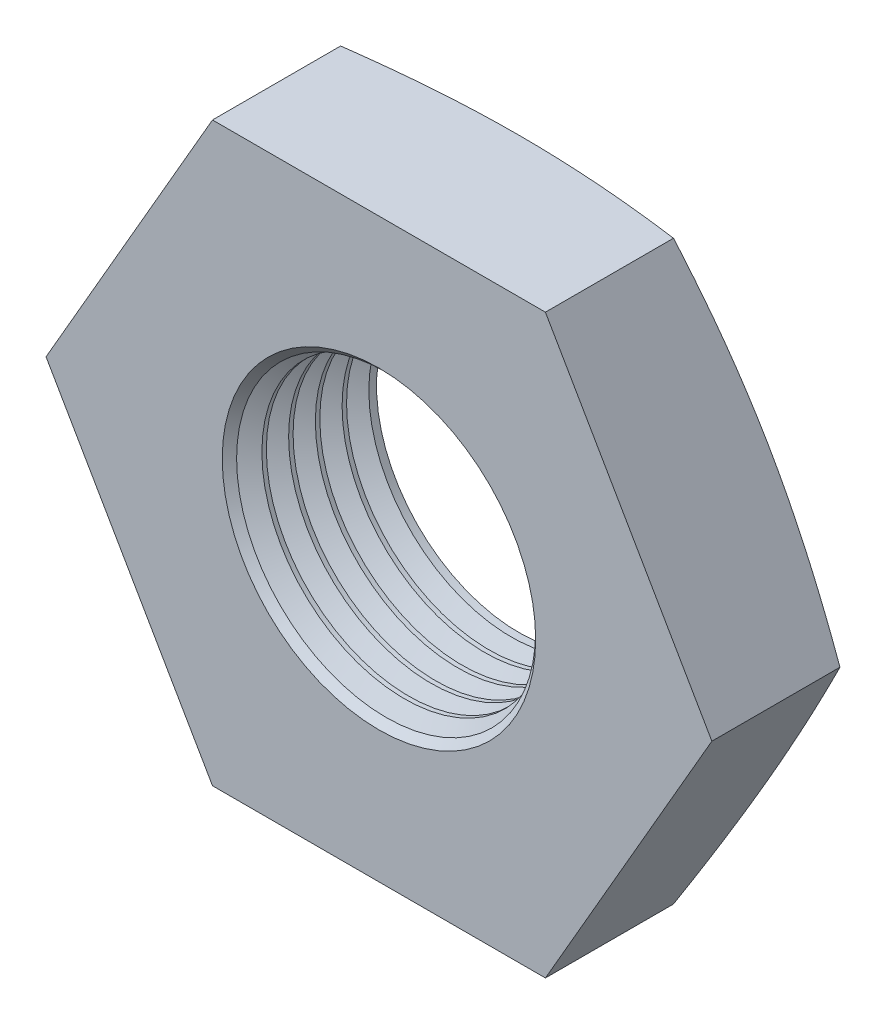
from build123d import *

# Parameters (mm, degrees)
SKETCH1_R        = 1.7295
BASENUT_DEPTH    = 1.7
CHAMFER1_SIZE    = 0.17295
LPATTERN10_COUNT = 5
LPATTERN10_PITCH = 0.3246


with BuildPart() as part:
    # Sketch1 → BaseNut (new body)
    with BuildSketch(Plane.XY):
        Polygon((2.020725942, -3.5), (4.041451884, 0), (2.020725942, 3.5), (-2.020725942, 3.5), (-4.041451884, 0), (-2.020725942, -3.5), align=None)
        Circle(SKETCH1_R, mode=Mode.SUBTRACT)
    extrude(amount=-BASENUT_DEPTH)

    # Sketch2 → Double-Chamfer (revolve, cut)
    with BuildSketch(Plane(origin=(0, 0, 0), x_dir=(1, 0, 0), z_dir=(0, 1, 0))):
        Polygon((-4.041451884, 1.7), (-3.5, 1.7), (-4.041451884, 1.554918405), align=None)
    revolve(axis=Axis((0, 0, -3.375940562), (0, 0, 1)), mode=Mode.SUBTRACT)

    # Chamfer1
    chamfer1_edges = [part.edges().sort_by_distance(p)[0] for p in [
        (-1.7295, 0, 0),
    ]]
    chamfer(chamfer1_edges, length=CHAMFER1_SIZE)

    # Sketch3 → Cut-Revolve10 (revolve, cut)
    with BuildSketch(Plane(origin=(0, 0, 0), x_dir=(1, 0, 0), z_dir=(0, 1, 0))):
        Polygon((1.459, 0.3082), (1.7295, 0.3082), (1.963759872, 0.17295), (1.7295, 0.0377), (1.459, 0.0377), align=None)
    cut_revolve10 = revolve(axis=Axis((0, 0, -2.739364781), (0, 0, 1)), mode=Mode.SUBTRACT)

    # LPattern10: Cut-Revolve10 ×5
    with Locations(*[(0, 0, -i * LPATTERN10_PITCH) for i in range(1, LPATTERN10_COUNT)]):
        add(cut_revolve10, mode=Mode.SUBTRACT)


solid = part.part
